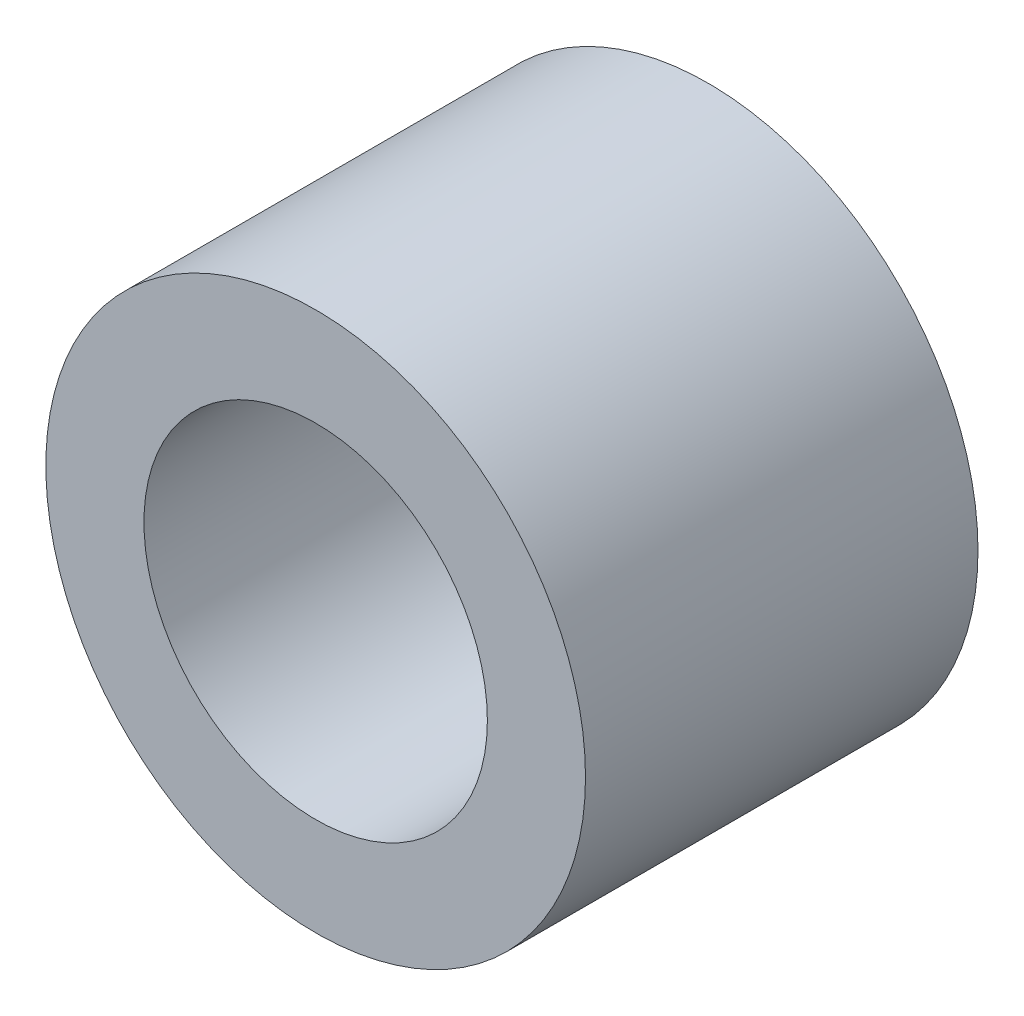
from build123d import *

# Parameters (mm, degrees)
SKETCH_1_R      = 2.75
SKETCH_1_R_2    = 1.75
EXTRUDE_1_DEPTH = 4


with BuildPart() as part:
    # 草图1 → 凸台-拉伸1 (new body)
    with BuildSketch(Plane.XY):
        Circle(SKETCH_1_R)
        Circle(SKETCH_1_R_2, mode=Mode.SUBTRACT)
    extrude(amount=EXTRUDE_1_DEPTH)


solid = part.part
